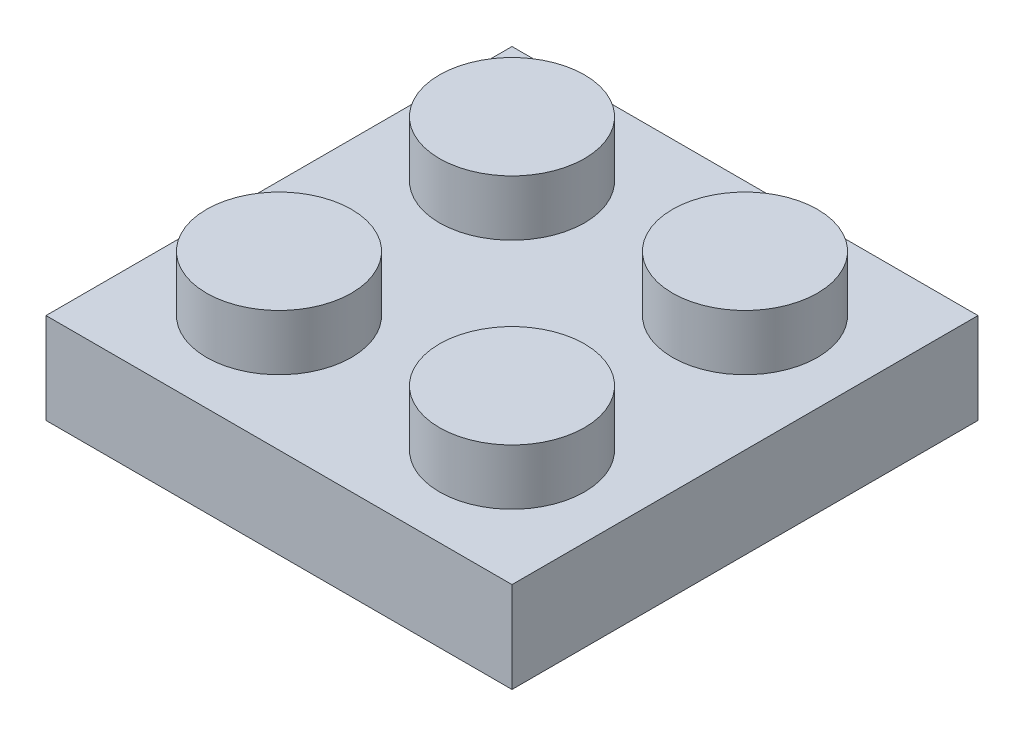
from build123d import *

# Parameters (mm, degrees)
SKETCH1_W           = 15.9
SKETCH1_H           = 15.9
BOSS_EXTRUDE1_DEPTH = 3.1
SKETCH2_W           = 12.9
SKETCH2_H           = 12.9
CUT_EXTRUDE1_DEPTH  = 1.9
SKETCH3_R           = 2.475
BOSS_EXTRUDE2_DEPTH = 1.9


with BuildPart() as part:
    # Sketch1 → Boss-Extrude1 (new body)
    with BuildSketch(Plane(origin=(0, 0, 0), x_dir=(1, 0, 0), z_dir=(0, 1, 0))):
        with Locations((-35.79416664, -41.816451592)):
            Rectangle(SKETCH1_W, SKETCH1_H)
    extrude(amount=BOSS_EXTRUDE1_DEPTH)

    # Sketch2 → Cut-Extrude1 (cut)
    with BuildSketch(Plane.XZ):
        with Locations((-35.79416664, 41.816451592)):
            Rectangle(SKETCH2_W, SKETCH2_H)
    extrude(amount=-CUT_EXTRUDE1_DEPTH, mode=Mode.SUBTRACT)

    # Sketch3 → Boss-Extrude2 (add)
    with BuildSketch(Plane(origin=(0, 3.1, 0), x_dir=(1, 0, 0), z_dir=(0, 1, 0))):
        with Locations(Location((-39.76916664, -37.841451592, 0), (0, 0, 90))):
            Circle(SKETCH3_R)
        with Locations(Location((-31.81916664, -37.841451592, 0), (0, 0, 90))):
            Circle(SKETCH3_R)
        with Locations(Location((-39.76916664, -45.791451592, 0), (0, 0, 90))):
            Circle(SKETCH3_R)
        with Locations(Location((-31.81916664, -45.791451592, 0), (0, 0, 90))):
            Circle(SKETCH3_R)
    extrude(amount=BOSS_EXTRUDE2_DEPTH)


solid = part.part
